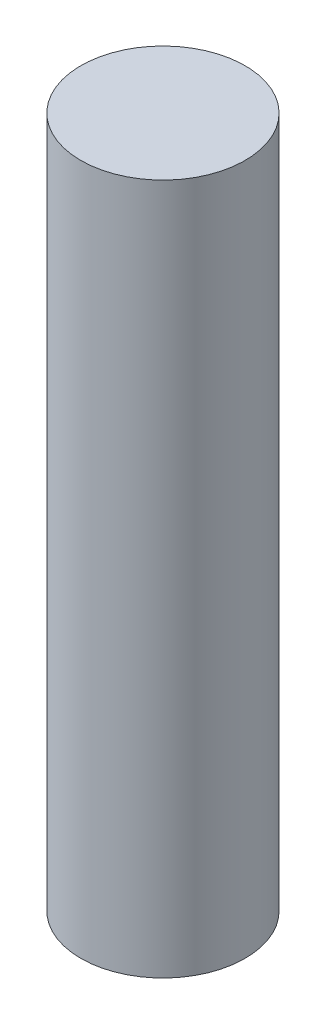
from build123d import *

# Parameters (mm, degrees)
SKETCH1_R           = 4
BOSS_EXTRUDE1_DEPTH = 33.655


with BuildPart() as part:
    # Sketch1 → Boss-Extrude1 (new body)
    with BuildSketch(Plane(origin=(0, 0, 0), x_dir=(1, 0, 0), z_dir=(0, 1, 0))):
        with Locations(Location((-1.869568361, 3.172600856, 0), (0, 0, 270))):
            Circle(SKETCH1_R)
    extrude(amount=BOSS_EXTRUDE1_DEPTH)


solid = part.part
